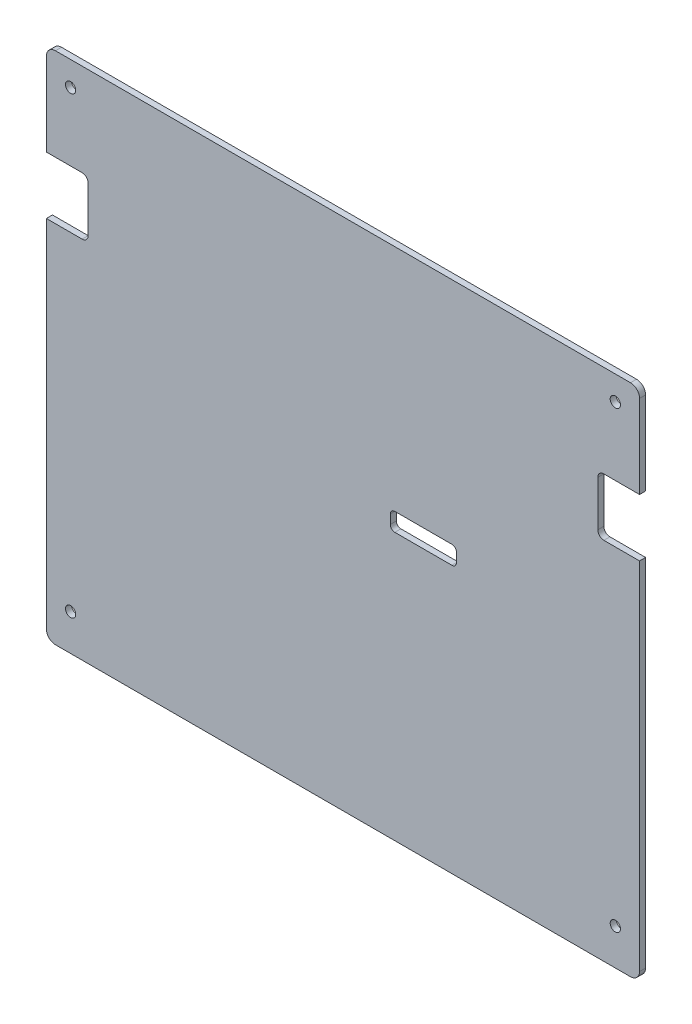
from build123d import *

# Parameters (mm, degrees)
ACRYLIC_2MM_START        = -12
ACRYLIC_2MM_DEPTH        = 2
HINGE_CLEARANCE_0_START  = -9.8
HINGE_CLEARANCE_0_DEPTH  = 2.4
HINGE_CLEARANCE_1_START  = -9.8
HINGE_CLEARANCE_1_DEPTH  = 2.4
M3_CLEARANCE_0_START     = -9.8
M3_CLEARANCE_0_PROFILE_R = 1.7
M3_CLEARANCE_0_DEPTH     = 2.4
M3_CLEARANCE_1_START     = -9.8
M3_CLEARANCE_1_PROFILE_R = 1.7
M3_CLEARANCE_1_DEPTH     = 2.4
M3_CLEARANCE_2_START     = -9.8
M3_CLEARANCE_2_PROFILE_R = 1.7
M3_CLEARANCE_2_DEPTH     = 2.4
M3_CLEARANCE_3_START     = -9.8
M3_CLEARANCE_3_PROFILE_R = 1.7
M3_CLEARANCE_3_DEPTH     = 2.4
KEYS_ACCESS_R1_5_START   = -9.8
KEYS_ACCESS_R1_5_DEPTH   = 2.4


with BuildPart() as part:
    # Acrylic_2mm_profile → Acrylic_2mm (new body)
    with BuildSketch(Plane.XY.offset(ACRYLIC_2MM_START)):
        with BuildLine():
            Line((0, -7), (190, -7))
            ThreePointArc((190, -7), (192.121320344, -6.121320344), (193, -4))
            Line((193, -4), (193, 160))
            ThreePointArc((193, 160), (192.121320344, 162.121320344), (190, 163))
            Line((190, 163), (0, 163))
            ThreePointArc((0, 163), (-2.121320344, 162.121320344), (-3, 160))
            Line((-3, 160), (-3, -4))
            ThreePointArc((-3, -4), (-2.121320344, -6.121320344), (0, -7))
        make_face()
    extrude(amount=ACRYLIC_2MM_DEPTH)

    # Hinge_clearance_0_profile → Hinge_clearance_0 (cut)
    with BuildSketch(Plane.XY.offset(HINGE_CLEARANCE_0_START)):
        with BuildLine():
            Line((-4, 113.5), (8.8, 113.5))
            ThreePointArc((8.8, 113.5), (10.214213562, 114.085786438), (10.8, 115.5))
            Line((10.8, 115.5), (10.8, 130.5))
            ThreePointArc((10.8, 130.5), (10.214213562, 131.914213562), (8.8, 132.5))
            Line((8.8, 132.5), (-4, 132.5))
            ThreePointArc((-4, 132.5), (-5.414213562, 131.914213562), (-6, 130.5))
            Line((-6, 130.5), (-6, 115.5))
            ThreePointArc((-6, 115.5), (-5.414213562, 114.085786438), (-4, 113.5))
        make_face()
    extrude(amount=-HINGE_CLEARANCE_0_DEPTH, mode=Mode.SUBTRACT)

    # Hinge_clearance_1_profile → Hinge_clearance_1 (cut)
    with BuildSketch(Plane.XY.offset(HINGE_CLEARANCE_1_START)):
        with BuildLine():
            Line((181.2, 113.5), (194, 113.5))
            ThreePointArc((194, 113.5), (195.414213562, 114.085786438), (196, 115.5))
            Line((196, 115.5), (196, 130.5))
            ThreePointArc((196, 130.5), (195.414213562, 131.914213562), (194, 132.5))
            Line((194, 132.5), (181.2, 132.5))
            ThreePointArc((181.2, 132.5), (179.785786438, 131.914213562), (179.2, 130.5))
            Line((179.2, 130.5), (179.2, 115.5))
            ThreePointArc((179.2, 115.5), (179.785786438, 114.085786438), (181.2, 113.5))
        make_face()
    extrude(amount=-HINGE_CLEARANCE_1_DEPTH, mode=Mode.SUBTRACT)

    # M3_clearance_0_profile → M3_clearance_0 (cut)
    with BuildSketch(Plane.XY.offset(M3_CLEARANCE_0_START)):
        with Locations((5, 5)):
            Circle(M3_CLEARANCE_0_PROFILE_R)
    extrude(amount=-M3_CLEARANCE_0_DEPTH, mode=Mode.SUBTRACT)

    # M3_clearance_1_profile → M3_clearance_1 (cut)
    with BuildSketch(Plane.XY.offset(M3_CLEARANCE_1_START)):
        with Locations((185, 5)):
            Circle(M3_CLEARANCE_1_PROFILE_R)
    extrude(amount=-M3_CLEARANCE_1_DEPTH, mode=Mode.SUBTRACT)

    # M3_clearance_2_profile → M3_clearance_2 (cut)
    with BuildSketch(Plane.XY.offset(M3_CLEARANCE_2_START)):
        with Locations((5, 155)):
            Circle(M3_CLEARANCE_2_PROFILE_R)
    extrude(amount=-M3_CLEARANCE_2_DEPTH, mode=Mode.SUBTRACT)

    # M3_clearance_3_profile → M3_clearance_3 (cut)
    with BuildSketch(Plane.XY.offset(M3_CLEARANCE_3_START)):
        with Locations((185, 155)):
            Circle(M3_CLEARANCE_3_PROFILE_R)
    extrude(amount=-M3_CLEARANCE_3_DEPTH, mode=Mode.SUBTRACT)

    # Keys_access_R1_5_profile → Keys_access_R1_5 (cut)
    with BuildSketch(Plane.XY.offset(KEYS_ACCESS_R1_5_START)):
        with BuildLine():
            Line((112.12500058, 81.24999704), (130.9999982, 81.24999704))
            ThreePointArc((130.9999982, 81.24999704), (132.060658372, 81.689336868), (132.4999982, 82.74999704))
            Line((132.4999982, 82.74999704), (132.4999982, 85.74999974))
            ThreePointArc((132.4999982, 85.74999974), (132.060658372, 86.810659912), (130.9999982, 87.24999974))
            Line((130.9999982, 87.24999974), (112.12500058, 87.24999974))
            ThreePointArc((112.12500058, 87.24999974), (111.064340408, 86.810659912), (110.62500058, 85.74999974))
            Line((110.62500058, 85.74999974), (110.62500058, 82.74999704))
            ThreePointArc((110.62500058, 82.74999704), (111.064340408, 81.689336868), (112.12500058, 81.24999704))
        make_face()
    extrude(amount=-KEYS_ACCESS_R1_5_DEPTH, mode=Mode.SUBTRACT)


solid = part.part
